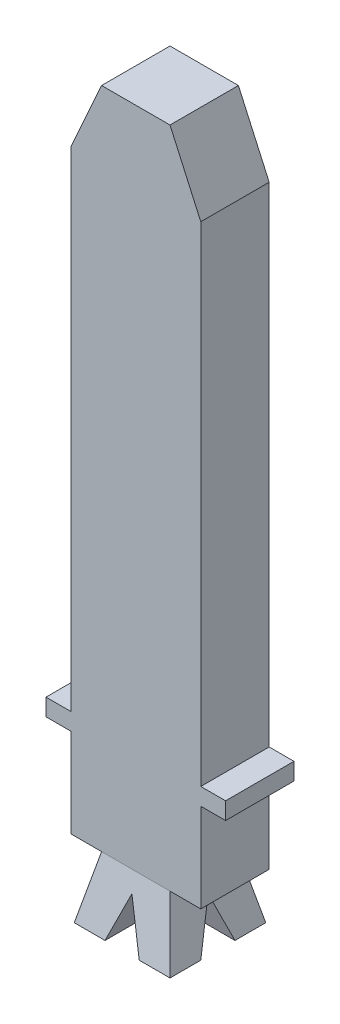
from build123d import *

# Parameters (mm, degrees)
BOSS_EXTRUDE1_DEPTH     = 2
CUT_EXTRUDE1_DEPTH      = 17.65594865
CUT_EXTRUDE1_DEPTH_BACK = 17.65594865
CUT_EXTRUDE2_DEPTH      = 18.404327791
CUT_EXTRUDE2_DEPTH_BACK = 18.404327791


with BuildPart() as part:
    # Sketch1 → Boss-Extrude1 (new body)
    with BuildSketch(Plane.XY):
        Polygon((1.9, 0), (2.625, 0), (2.625, -0.5), (1.9, -0.5), (1.9, -3.1), (-1.9, -3.1), (-1.9, -0.5), (-2.625, -0.5), (-2.625, 0), (-1.9, 0), (-1.9, 14.3), (-1, 16.3), (1, 16.3), (1.9, 14.3), align=None)
    extrude(amount=BOSS_EXTRUDE1_DEPTH)


with BuildPart() as body_2:
    # Sketch2 → Loft1 section 0
    with BuildSketch(Plane.XZ.offset(3.1)):
        with BuildLine():
            Line((-1, 2), (1, 2))
            Line((1, 2), (1, 0))
            Line((1, 0), (-1, 0))
            Line((-1, 0), (-1, 2))
        make_face()
    # Sketch3 → Loft1 section 1
    with BuildSketch(Plane(origin=(0, -4.9, 0), x_dir=(-1, 0, 0), z_dir=(0, -1, 0))):
        with BuildLine():
            Line((-1.4, 0.4), (1.4, 0.4))
            Line((1.4, 0.4), (1.4, -2.4))
            Line((1.4, -2.4), (-1.4, -2.4))
            Line((-1.4, -2.4), (-1.4, 0.4))
        make_face()
    loft()

    # Sketch4 → Cut-Extrude1 (cut, two sides: drawn at the far end of the back side and taken through both)
    with BuildSketch(Plane.XY.offset(1.8).offset(-CUT_EXTRUDE1_DEPTH_BACK)):
        Polygon((0, -3.611513086), (-0.5, -4.9), (0.5, -4.9), align=None)
    extrude(amount=CUT_EXTRUDE1_DEPTH + CUT_EXTRUDE1_DEPTH_BACK, mode=Mode.SUBTRACT)

    # Sketch5 → Cut-Extrude2 (cut, two sides: drawn at the far end of the back side and taken through both)
    with BuildSketch(Plane(origin=(1.8, 0, -1.8), x_dir=(0, 0, 1), z_dir=(-1, 0, 0)).offset(-CUT_EXTRUDE2_DEPTH_BACK)):
        Polygon((2.8, -3.611513086), (2.3, -4.9), (3.3, -4.9), align=None)
    extrude(amount=CUT_EXTRUDE2_DEPTH + CUT_EXTRUDE2_DEPTH_BACK, mode=Mode.SUBTRACT)


solid = Compound([part.part, body_2.part])
